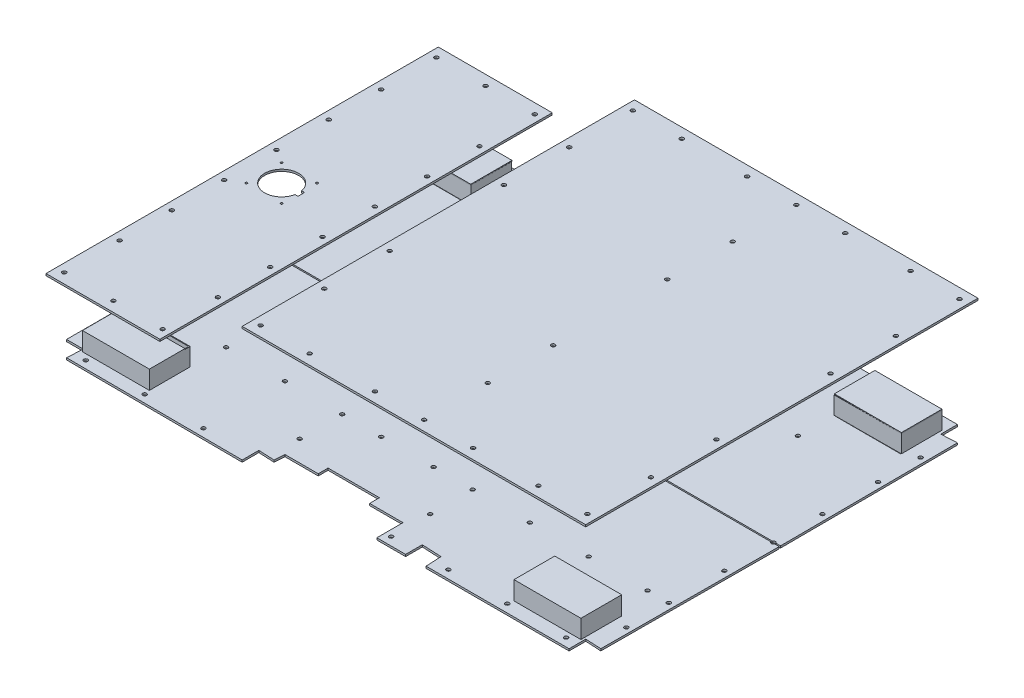
from build123d import *

# Parameters (mm, degrees)
SKETCH2_R             = 3
BOSS_EXTRUDE1_DEPTH   = 3
BOSS_EXTRUDE1_2_DEPTH = 3
SKETCH4_W             = 525.4
SKETCH4_H             = 600
SKETCH4_R             = 3
BOSS_EXTRUDE2_DEPTH   = 3
SKETCH6_R             = 3
BOSS_EXTRUDE3_DEPTH   = 3
CUT_EXTRUDE1_DEPTH    = 3
SKETCH10_R            = 1.6
CUT_EXTRUDE4_DEPTH    = 3
SKETCH11_W            = 78.6
SKETCH11_H            = 15
CUT_EXTRUDE5_DEPTH    = 3
SKETCH13_W            = 100
SKETCH13_H            = 60
CUT_EXTRUDE6_DEPTH    = 3
BOSS_EXTRUDE4_START   = -3
SKETCH15_W            = 102.4
SKETCH15_H            = 62.4
SKETCH15_W_2          = 100
SKETCH15_H_2          = 60
BOSS_EXTRUDE4_DEPTH   = 27
SKETCH16_W            = 102.4
SKETCH16_H            = 62.4
SKETCH16_W_2          = 102.648833796
SKETCH16_H_2          = 61.989813037
SKETCH16_H_3          = 54.4
SKETCH16_W_3          = 102.148236992
SKETCH16_H_4          = 63.131643033
BOSS_EXTRUDE5_DEPTH   = 1.2


with BuildPart() as part:
    # Sketch2 → Boss-Extrude1 (new body)
    with BuildSketch(Plane(origin=(0, 422.059491285, 0), x_dir=(1, 0, 0), z_dir=(0, 1, 0))):
        with BuildLine():
            Line((713.290709389, -658.095168064), (712.108773643, -386.446935813))
            Line((712.108773643, -386.446935813), (687.895088764, -387.647614403))
            Line((687.895088764, -387.647614403), (687.895088764, -362.095168064))
            Line((687.895088764, -362.095168064), (469.150014442, -362.095168064))
            Line((469.150014442, -362.095168064), (467.956868347, -386.156947646))
            Line((467.956868347, -386.156947646), (437.895088764, -387.647614403))
            Line((437.895088764, -387.647614403), (437.895088764, -362.095168064))
            Line((437.895088764, -362.095168064), (393.895088764, -362.095168064))
            Line((393.895088764, -362.095168064), (393.895088764, -402.095168064))
            Line((393.895088764, -402.095168064), (213.514296848, -402.095168064))
            Line((213.514296848, -402.095168064), (212.325009151, -386.436213392))
            Line((212.325009151, -386.436213392), (187.895088764, -387.647614403))
            Line((187.895088764, -387.647614403), (187.895088764, -362.108249397))
            Line((187.895088764, -362.108249397), (-81.753143486, -363.281483185))
            Line((-81.753143486, -363.281483185), (-80.552464897, -387.495168064))
            Line((-80.552464897, -387.495168064), (-106.104911236, -387.495168064))
            Line((-106.104911236, -387.495168064), (-106.104911236, -658.095168064))
            Line((-106.104911236, -658.095168064), (-99.03333836, -658.095168064))
            ThreePointArc((-99.03333836, -658.095168064), (-96.204911236, -656.095168064), (-93.376484111, -658.095168064))
            Line((-93.376484111, -658.095168064), (200.96666164, -658.095168064))
            ThreePointArc((200.96666164, -658.095168064), (203.795088764, -656.095168064), (206.623515889, -658.095168064))
            Line((206.623515889, -658.095168064), (400.56666164, -658.095168064))
            ThreePointArc((400.56666164, -658.095168064), (403.395088764, -656.095168064), (406.223515889, -658.095168064))
            Line((406.223515889, -658.095168064), (700.56666164, -658.095168064))
            ThreePointArc((700.56666164, -658.095168064), (703.395088764, -656.095168064), (706.223515889, -658.095168064))
            Line((706.223515889, -658.095168064), (713.290709389, -658.095168064))
        make_face()
        with Locations(Location((-96.204911236, -584.095168064, 0), (0, 0, 270))):
            Circle(SKETCH2_R, mode=Mode.SUBTRACT)
        with Locations(Location((203.795088764, -584.095168064, 0), (0, 0, 270))):
            Circle(SKETCH2_R, mode=Mode.SUBTRACT)
        with Locations(Location((-96.204911236, -499.095168064, 0), (0, 0, 270))):
            Circle(SKETCH2_R, mode=Mode.SUBTRACT)
        with Locations(Location((-63.704911236, -499.095168064, 0), (0, 0, 270))):
            Circle(SKETCH2_R, mode=Mode.SUBTRACT)
        with Locations(Location((-96.204911236, -434.095168064, 0), (0, 0, 270))):
            Circle(SKETCH2_R, mode=Mode.SUBTRACT)
        with Locations(Location((26.295088764, -499.095168064, 0), (0, 0, 270))):
            Circle(SKETCH2_R, mode=Mode.SUBTRACT)
        with Locations(Location((-63.704911236, -374.495168064, 0), (0, 0, 270))):
            Circle(SKETCH2_R, mode=Mode.SUBTRACT)
        with Locations(Location((26.295088764, -374.495168064, 0), (0, 0, 270))):
            Circle(SKETCH2_R, mode=Mode.SUBTRACT)
        with Locations(Location((116.295088764, -499.095168064, 0), (0, 0, 270))):
            Circle(SKETCH2_R, mode=Mode.SUBTRACT)
        with Locations(Location((203.795088764, -499.095168064, 0), (0, 0, 270))):
            Circle(SKETCH2_R, mode=Mode.SUBTRACT)
        with Locations(Location((263.595088764, -499.095168064, 0), (0, 0, 270))):
            Circle(SKETCH2_R, mode=Mode.SUBTRACT)
        with Locations(Location((203.795088764, -434.095168064, 0), (0, 0, 270))):
            Circle(SKETCH2_R, mode=Mode.SUBTRACT)
        with Locations(Location((116.295088764, -374.495168064, 0), (0, 0, 270))):
            Circle(SKETCH2_R, mode=Mode.SUBTRACT)
        with Locations(Location((403.395088764, -584.095168064, 0), (0, 0, 270))):
            Circle(SKETCH2_R, mode=Mode.SUBTRACT)
        with Locations(Location((703.395088764, -584.095168064, 0), (0, 0, 270))):
            Circle(SKETCH2_R, mode=Mode.SUBTRACT)
        with Locations(Location((343.595088764, -499.095168064, 0), (0, 0, 270))):
            Circle(SKETCH2_R, mode=Mode.SUBTRACT)
        with Locations(Location((403.395088764, -499.095168064, 0), (0, 0, 270))):
            Circle(SKETCH2_R, mode=Mode.SUBTRACT)
        with Locations(Location((403.395088764, -434.095168064, 0), (0, 0, 270))):
            Circle(SKETCH2_R, mode=Mode.SUBTRACT)
        with Locations(Location((490.895088764, -499.095168064, 0), (0, 0, 270))):
            Circle(SKETCH2_R, mode=Mode.SUBTRACT)
        with Locations(Location((403.395088764, -374.495168064, 0), (0, 0, 270))):
            Circle(SKETCH2_R, mode=Mode.SUBTRACT)
        with Locations(Location((490.895088764, -374.495168064, 0), (0, 0, 270))):
            Circle(SKETCH2_R, mode=Mode.SUBTRACT)
        with Locations(Location((580.895088764, -499.095168064, 0), (0, 0, 270))):
            Circle(SKETCH2_R, mode=Mode.SUBTRACT)
        with Locations(Location((703.395088764, -499.095168064, 0), (0, 0, 270))):
            Circle(SKETCH2_R, mode=Mode.SUBTRACT)
        with Locations(Location((703.395088764, -434.095168064, 0), (0, 0, 270))):
            Circle(SKETCH2_R, mode=Mode.SUBTRACT)
        with Locations(Location((580.895088764, -374.495168064, 0), (0, 0, 270))):
            Circle(SKETCH2_R, mode=Mode.SUBTRACT)
        with Locations(Location((670.895088764, -374.495168064, 0), (0, 0, 270))):
            Circle(SKETCH2_R, mode=Mode.SUBTRACT)
    extrude(amount=BOSS_EXTRUDE1_DEPTH)


with BuildPart() as body_2:
    # Sketch2 → Boss-Extrude1 2 (new body)
    with BuildSketch(Plane(origin=(0, 422.059491285, 0), x_dir=(1, 0, 0), z_dir=(0, 1, 0))):
        with BuildLine():
            ThreePointArc((706.223515889, -660.095168064), (703.395088764, -662.095168064), (700.56666164, -660.095168064))
            Line((700.56666164, -660.095168064), (406.223515889, -660.095168064))
            ThreePointArc((406.223515889, -660.095168064), (403.395088764, -662.095168064), (400.56666164, -660.095168064))
            Line((400.56666164, -660.095168064), (206.623515889, -660.095168064))
            ThreePointArc((206.623515889, -660.095168064), (203.795088764, -662.095168064), (200.96666164, -660.095168064))
            Line((200.96666164, -660.095168064), (-93.376484111, -660.095168064))
            ThreePointArc((-93.376484111, -660.095168064), (-96.204911236, -662.095168064), (-99.03333836, -660.095168064))
            Line((-99.03333836, -660.095168064), (-106.104911236, -660.095168064))
            Line((-106.104911236, -660.095168064), (-106.104911236, -930.695168064))
            Line((-106.104911236, -930.695168064), (-80.552464897, -930.695168064))
            Line((-80.552464897, -930.695168064), (-81.753143486, -954.908852943))
            Line((-81.753143486, -954.908852943), (187.895088764, -956.08208673))
            Line((187.895088764, -956.08208673), (187.895088764, -930.542721725))
            Line((187.895088764, -930.542721725), (212.325009151, -931.754122736))
            Line((212.325009151, -931.754122736), (213.514296848, -916.095168064))
            Line((213.514296848, -916.095168064), (393.895088764, -916.095168064))
            Line((393.895088764, -916.095168064), (393.895088764, -956.095168064))
            Line((393.895088764, -956.095168064), (437.895088764, -956.095168064))
            Line((437.895088764, -956.095168064), (437.895088764, -930.542721725))
            Line((437.895088764, -930.542721725), (467.956868347, -932.033388481))
            Line((467.956868347, -932.033388481), (469.150014442, -956.095168064))
            Line((469.150014442, -956.095168064), (687.895088764, -956.095168064))
            Line((687.895088764, -956.095168064), (687.895088764, -930.542721725))
            Line((687.895088764, -930.542721725), (712.108773643, -931.743400314))
            Line((712.108773643, -931.743400314), (713.290709389, -660.095168064))
            Line((713.290709389, -660.095168064), (706.223515889, -660.095168064))
        make_face()
        with Locations(Location((-63.704911236, -943.695168064, 0), (0, 0, 270))):
            Circle(SKETCH2_R, mode=Mode.SUBTRACT)
        with Locations(Location((26.295088764, -943.695168064, 0), (0, 0, 270))):
            Circle(SKETCH2_R, mode=Mode.SUBTRACT)
        with Locations(Location((-96.204911236, -884.095168064, 0), (0, 0, 270))):
            Circle(SKETCH2_R, mode=Mode.SUBTRACT)
        with Locations(Location((-96.204911236, -819.095168064, 0), (0, 0, 270))):
            Circle(SKETCH2_R, mode=Mode.SUBTRACT)
        with Locations(Location((-63.704911236, -819.095168064, 0), (0, 0, 270))):
            Circle(SKETCH2_R, mode=Mode.SUBTRACT)
        with Locations(Location((26.295088764, -819.095168064, 0), (0, 0, 270))):
            Circle(SKETCH2_R, mode=Mode.SUBTRACT)
        with Locations(Location((116.295088764, -943.695168064, 0), (0, 0, 270))):
            Circle(SKETCH2_R, mode=Mode.SUBTRACT)
        with Locations(Location((116.295088764, -819.095168064, 0), (0, 0, 270))):
            Circle(SKETCH2_R, mode=Mode.SUBTRACT)
        with Locations(Location((203.795088764, -884.095168064, 0), (0, 0, 270))):
            Circle(SKETCH2_R, mode=Mode.SUBTRACT)
        with Locations(Location((203.795088764, -819.095168064, 0), (0, 0, 270))):
            Circle(SKETCH2_R, mode=Mode.SUBTRACT)
        with Locations(Location((263.595088764, -819.095168064, 0), (0, 0, 270))):
            Circle(SKETCH2_R, mode=Mode.SUBTRACT)
        with Locations(Location((-96.204911236, -734.095168064, 0), (0, 0, 270))):
            Circle(SKETCH2_R, mode=Mode.SUBTRACT)
        with Locations(Location((203.795088764, -734.095168064, 0), (0, 0, 270))):
            Circle(SKETCH2_R, mode=Mode.SUBTRACT)
        with Locations(Location((403.395088764, -943.695168064, 0), (0, 0, 270))):
            Circle(SKETCH2_R, mode=Mode.SUBTRACT)
        with Locations(Location((490.895088764, -943.695168064, 0), (0, 0, 270))):
            Circle(SKETCH2_R, mode=Mode.SUBTRACT)
        with Locations(Location((403.395088764, -884.095168064, 0), (0, 0, 270))):
            Circle(SKETCH2_R, mode=Mode.SUBTRACT)
        with Locations(Location((343.595088764, -819.095168064, 0), (0, 0, 270))):
            Circle(SKETCH2_R, mode=Mode.SUBTRACT)
        with Locations(Location((403.395088764, -819.095168064, 0), (0, 0, 270))):
            Circle(SKETCH2_R, mode=Mode.SUBTRACT)
        with Locations(Location((490.895088764, -819.095168064, 0), (0, 0, 270))):
            Circle(SKETCH2_R, mode=Mode.SUBTRACT)
        with Locations(Location((580.895088764, -943.695168064, 0), (0, 0, 270))):
            Circle(SKETCH2_R, mode=Mode.SUBTRACT)
        with Locations(Location((670.895088764, -943.695168064, 0), (0, 0, 270))):
            Circle(SKETCH2_R, mode=Mode.SUBTRACT)
        with Locations(Location((580.895088764, -819.095168064, 0), (0, 0, 270))):
            Circle(SKETCH2_R, mode=Mode.SUBTRACT)
        with Locations(Location((703.395088764, -884.095168064, 0), (0, 0, 270))):
            Circle(SKETCH2_R, mode=Mode.SUBTRACT)
        with Locations(Location((670.895088764, -819.095168064, 0), (0, 0, 270))):
            Circle(SKETCH2_R, mode=Mode.SUBTRACT)
        with Locations(Location((703.395088764, -819.095168064, 0), (0, 0, 270))):
            Circle(SKETCH2_R, mode=Mode.SUBTRACT)
        with Locations(Location((403.395088764, -734.095168064, 0), (0, 0, 270))):
            Circle(SKETCH2_R, mode=Mode.SUBTRACT)
        with Locations(Location((703.395088764, -734.095168064, 0), (0, 0, 270))):
            Circle(SKETCH2_R, mode=Mode.SUBTRACT)
    extrude(amount=BOSS_EXTRUDE1_2_DEPTH)


with BuildPart() as body_3:
    # Sketch4 → Boss-Extrude2 (new body)
    with BuildSketch(Plane(origin=(0, 602.059491285, 0), x_dir=(1, 0, 0), z_dir=(0, 1, 0))):
        with Locations((453.595088764, -659.095168064)):
            Rectangle(SKETCH4_W, SKETCH4_H)
        with Locations(Location((453.795088764, -746.395168064, 0), (0, 0, 270))):
            Circle(SKETCH4_R, mode=Mode.SUBTRACT)
        with Locations(Location((203.795088764, -846.395168064, 0), (0, 0, 270))):
            Circle(SKETCH4_R, mode=Mode.SUBTRACT)
        with Locations(Location((203.795088764, -746.395168064, 0), (0, 0, 270))):
            Circle(SKETCH4_R, mode=Mode.SUBTRACT)
        with Locations(Location((203.795088764, -943.695168064, 0), (0, 0, 270))):
            Circle(SKETCH4_R, mode=Mode.SUBTRACT)
        with Locations(Location((278.595088764, -943.695168064, 0), (0, 0, 270))):
            Circle(SKETCH4_R, mode=Mode.SUBTRACT)
        with Locations(Location((378.595088764, -943.695168064, 0), (0, 0, 270))):
            Circle(SKETCH4_R, mode=Mode.SUBTRACT)
        with Locations(Location((453.795088764, -846.395168064, 0), (0, 0, 270))):
            Circle(SKETCH4_R, mode=Mode.SUBTRACT)
        with Locations(Location((453.795088764, -943.695168064, 0), (0, 0, 270))):
            Circle(SKETCH4_R, mode=Mode.SUBTRACT)
        with Locations(Location((703.395088764, -746.395168064, 0), (0, 0, 270))):
            Circle(SKETCH4_R, mode=Mode.SUBTRACT)
        with Locations(Location((703.395088764, -846.395168064, 0), (0, 0, 270))):
            Circle(SKETCH4_R, mode=Mode.SUBTRACT)
        with Locations(Location((528.595088764, -943.695168064, 0), (0, 0, 270))):
            Circle(SKETCH4_R, mode=Mode.SUBTRACT)
        with Locations(Location((703.395088764, -943.695168064, 0), (0, 0, 270))):
            Circle(SKETCH4_R, mode=Mode.SUBTRACT)
        with Locations(Location((628.595088764, -943.695168064, 0), (0, 0, 270))):
            Circle(SKETCH4_R, mode=Mode.SUBTRACT)
        with Locations(Location((628.595088764, -374.495168064, 0), (0, 0, 90))):
            Circle(SKETCH4_R, mode=Mode.SUBTRACT)
        with Locations(Location((703.395088764, -374.495168064, 0), (0, 0, 90))):
            Circle(SKETCH4_R, mode=Mode.SUBTRACT)
        with Locations(Location((528.595088764, -374.495168064, 0), (0, 0, 90))):
            Circle(SKETCH4_R, mode=Mode.SUBTRACT)
        with Locations(Location((703.395088764, -471.795168064, 0), (0, 0, 90))):
            Circle(SKETCH4_R, mode=Mode.SUBTRACT)
        with Locations(Location((703.395088764, -571.795168064, 0), (0, 0, 90))):
            Circle(SKETCH4_R, mode=Mode.SUBTRACT)
        with Locations(Location((453.795088764, -374.495168064, 0), (0, 0, 90))):
            Circle(SKETCH4_R, mode=Mode.SUBTRACT)
        with Locations(Location((453.795088764, -471.795168064, 0), (0, 0, 90))):
            Circle(SKETCH4_R, mode=Mode.SUBTRACT)
        with Locations(Location((378.595088764, -374.495168064, 0), (0, 0, 90))):
            Circle(SKETCH4_R, mode=Mode.SUBTRACT)
        with Locations(Location((278.595088764, -374.495168064, 0), (0, 0, 90))):
            Circle(SKETCH4_R, mode=Mode.SUBTRACT)
        with Locations(Location((203.795088764, -374.495168064, 0), (0, 0, 90))):
            Circle(SKETCH4_R, mode=Mode.SUBTRACT)
        with Locations(Location((203.795088764, -571.795168064, 0), (0, 0, 90))):
            Circle(SKETCH4_R, mode=Mode.SUBTRACT)
        with Locations(Location((203.795088764, -471.795168064, 0), (0, 0, 90))):
            Circle(SKETCH4_R, mode=Mode.SUBTRACT)
        with Locations(Location((453.795088764, -571.795168064, 0), (0, 0, 90))):
            Circle(SKETCH4_R, mode=Mode.SUBTRACT)
    extrude(amount=BOSS_EXTRUDE2_DEPTH)


with BuildPart() as body_4:
    # Sketch6 → Boss-Extrude3 (new body)
    with BuildSketch(Plane(origin=(0, 522.059491285, 0), x_dir=(1, 0, 0), z_dir=(0, 1, 0))):
        Polygon((-109.104911236, -959.095168064), (-109.104911236, -359.095168064), (65.095088764, -359.095168064), (65.095088764, -384.495168064), (65.095088764, -933.695168064), (65.095088764, -959.095168064), align=None)
        with Locations(Location((-96.604911236, -943.695168064, 0), (0, 0, 270))):
            Circle(SKETCH6_R, mode=Mode.SUBTRACT)
        with Locations(Location((-21.399911236, -943.695168064, 0), (0, 0, 270))):
            Circle(SKETCH6_R, mode=Mode.SUBTRACT)
        with Locations(Location((53.795088764, -943.695168064, 0), (0, 0, 270))):
            Circle(SKETCH6_R, mode=Mode.SUBTRACT)
        with Locations(Location((-96.604911236, -859.095168064, 0), (0, 0, 270))):
            Circle(SKETCH6_R, mode=Mode.SUBTRACT)
        with Locations(Location((53.795088764, -859.095168064, 0), (0, 0, 270))):
            Circle(SKETCH6_R, mode=Mode.SUBTRACT)
        with Locations(Location((53.795088764, -699.095168064, 0), (0, 0, 270))):
            Circle(SKETCH6_R, mode=Mode.SUBTRACT)
        with Locations(Location((-96.604911236, -699.095168064, 0), (0, 0, 270))):
            Circle(SKETCH6_R, mode=Mode.SUBTRACT)
        with Locations(Location((53.795088764, -779.095168064, 0), (0, 0, 270))):
            Circle(SKETCH6_R, mode=Mode.SUBTRACT)
        with Locations(Location((-96.604911236, -779.095168064, 0), (0, 0, 270))):
            Circle(SKETCH6_R, mode=Mode.SUBTRACT)
        with Locations(Location((-96.604911236, -619.095168064, 0), (0, 0, 90))):
            Circle(SKETCH6_R, mode=Mode.SUBTRACT)
        with Locations(Location((-96.604911236, -539.095168064, 0), (0, 0, 90))):
            Circle(SKETCH6_R, mode=Mode.SUBTRACT)
        with Locations(Location((53.795088764, -539.095168064, 0), (0, 0, 90))):
            Circle(SKETCH6_R, mode=Mode.SUBTRACT)
        with Locations(Location((53.795088764, -619.095168064, 0), (0, 0, 90))):
            Circle(SKETCH6_R, mode=Mode.SUBTRACT)
        with Locations(Location((53.795088764, -459.095168064, 0), (0, 0, 90))):
            Circle(SKETCH6_R, mode=Mode.SUBTRACT)
        with Locations(Location((-96.604911236, -459.095168064, 0), (0, 0, 90))):
            Circle(SKETCH6_R, mode=Mode.SUBTRACT)
        with Locations(Location((53.795088764, -374.495168064, 0), (0, 0, 90))):
            Circle(SKETCH6_R, mode=Mode.SUBTRACT)
        with Locations(Location((-21.399911236, -374.495168064, 0), (0, 0, 90))):
            Circle(SKETCH6_R, mode=Mode.SUBTRACT)
        with Locations(Location((-96.604911236, -374.495168064, 0), (0, 0, 90))):
            Circle(SKETCH6_R, mode=Mode.SUBTRACT)
    extrude(amount=BOSS_EXTRUDE3_DEPTH)

    # Sketch9 → Cut-Extrude1 (cut)
    with BuildSketch(Plane(origin=(0, 525.059491285, 0), x_dir=(1, 0, 0), z_dir=(0, 1, 0))):
        with BuildLine():
            Line((-23.190209591, -654.095168064), (-18.690209591, -654.095168064))
            Line((-18.690209591, -654.095168064), (-18.690209591, -664.095168064))
            Line((-18.690209591, -664.095168064), (-23.190209591, -664.095168064))
            ThreePointArc((-23.190209591, -664.095168064), (-74.704911236, -659.095168064), (-23.190209591, -654.095168064))
        make_face()
    extrude(amount=-CUT_EXTRUDE1_DEPTH, mode=Mode.SUBTRACT)

    # Sketch10 → Cut-Extrude4 (cut)
    with BuildSketch(Plane(origin=(0, 525.059491285, 0), x_dir=(1, 0, 0), z_dir=(0, 1, 0))):
        with Locations(Location((-21.704911236, -632.095168064, 0), (0, 0, 270))):
            Circle(SKETCH10_R)
        with Locations(Location((-21.704911236, -686.095168064, 0), (0, 0, 270))):
            Circle(SKETCH10_R)
        with Locations(Location((-75.704911236, -632.095168064, 0), (0, 0, 270))):
            Circle(SKETCH10_R)
        with Locations(Location((-75.704911236, -686.095168064, 0), (0, 0, 270))):
            Circle(SKETCH10_R)
    extrude(amount=-CUT_EXTRUDE4_DEPTH, mode=Mode.SUBTRACT)


with BuildPart() as cut_extrude5_tool:
    # Sketch11 → Cut-Extrude5 (new body)
    with BuildSketch(Plane.XZ.offset(-422.059491285)):
        with Locations((303.595088764, 908.595168064)):
            Rectangle(SKETCH11_W, SKETCH11_H)
        with Locations((303.595088764, 409.595168064)):
            Rectangle(SKETCH11_W, SKETCH11_H)
    extrude(amount=-CUT_EXTRUDE5_DEPTH)


with BuildPart() as part_1:
    add(part.part)

    # Cut-Extrude5: cut by cut_extrude5_tool
    add(cut_extrude5_tool.part, mode=Mode.SUBTRACT)


with BuildPart() as body_2_1:
    add(body_2.part)

    # Cut-Extrude5: cut by cut_extrude5_tool
    add(cut_extrude5_tool.part, mode=Mode.SUBTRACT)


with BuildPart() as cut_extrude6_tool:
    # Sketch13 → Cut-Extrude6 (new body)
    with BuildSketch(Plane.XZ.offset(-422.059491285)):
        with Locations((633.595088764, 903.695168064)):
            Rectangle(SKETCH13_W, SKETCH13_H)
        with Locations((633.595088764, 414.495168064)):
            Rectangle(SKETCH13_W, SKETCH13_H)
        with Locations((-26.404911236, 903.695168064)):
            Rectangle(SKETCH13_W, SKETCH13_H)
        with Locations((-26.404911236, 414.495168064)):
            Rectangle(SKETCH13_W, SKETCH13_H)
    extrude(amount=-CUT_EXTRUDE6_DEPTH)


with BuildPart() as part_2:
    add(part_1.part)

    # Cut-Extrude6: cut by cut_extrude6_tool
    add(cut_extrude6_tool.part, mode=Mode.SUBTRACT)



with BuildPart() as body_2_2:
    add(body_2_1.part)

    # Cut-Extrude6: cut by cut_extrude6_tool
    add(cut_extrude6_tool.part, mode=Mode.SUBTRACT)


with BuildPart() as part_3:
    add(part_2.part)

    add(body_2_2.part)  # Boss-Extrude4 merges body 2
    # Sketch15 → Boss-Extrude4 (add)
    # profile 1 of 4: a face of its own
    with BuildSketch(Plane.XZ.offset(-422.059491285).offset(BOSS_EXTRUDE4_START)):
        with Locations((633.595088764, 903.695168064)):
            Rectangle(SKETCH15_W, SKETCH15_H)
        with Locations((633.595088764, 903.695168064)):
            Rectangle(SKETCH15_W_2, SKETCH15_H_2, mode=Mode.SUBTRACT)
    # profile 2 of 4: a face of its own
    with BuildSketch(Plane.XZ.offset(-422.059491285).offset(BOSS_EXTRUDE4_START)):
        Polygon((683.687880176, 381.411390264), (581.288699729, 381.821077812), (581.538353079, 444.220578396), (683.937533525, 443.810890849), align=None)
        Polygon((682.732742103, 442.615701479), (682.492690806, 382.616181686), (582.493491151, 383.016267182), (582.733542449, 443.015786975), align=None, mode=Mode.SUBTRACT)
    # profile 3 of 4: a face of its own
    with BuildSketch(Plane.XZ.offset(-422.059491285).offset(BOSS_EXTRUDE4_START)):
        Polygon((25.901477799, 381.821077812), (25.65182445, 444.220578396), (-76.747355996, 443.810890849), (-76.497702647, 381.411390264), align=None)
        Polygon((24.696686377, 383.016267182), (24.45663508, 443.015786975), (-75.542564575, 442.615701479), (-75.302513277, 382.616181686), align=None, mode=Mode.SUBTRACT)
    # profile 4 of 4: a face of its own
    with BuildSketch(Plane.XZ.offset(-422.059491285).offset(BOSS_EXTRUDE4_START)):
        with Locations((-26.404911236, 903.695168064)):
            Rectangle(SKETCH15_W, SKETCH15_H)
        with Locations((-26.404911236, 903.695168064)):
            Rectangle(SKETCH15_W_2, SKETCH15_H_2, mode=Mode.SUBTRACT)
    extrude(amount=-BOSS_EXTRUDE4_DEPTH)

    # Sketch16 → Boss-Extrude5 (add)
    with BuildSketch(Plane(origin=(0, 452.059491285, 0), x_dir=(-1, 0, 0), z_dir=(0, 1, 0))):
        with Locations((-633.595088764, 903.695168064)):
            Rectangle(SKETCH16_W, SKETCH16_H)
        with Locations((-632.613116627, 412.81598433)):
            Rectangle(SKETCH16_W_2, SKETCH16_H_2)
        with Locations((26.404911236, 907.695168064)):
            Rectangle(SKETCH16_W, SKETCH16_H_3)
        with Locations((25.422294046, 412.65475688)):
            Rectangle(SKETCH16_W_3, SKETCH16_H_4)
    extrude(amount=BOSS_EXTRUDE5_DEPTH)


solid = Compound([body_3.part, body_4.part, part_3.part])
